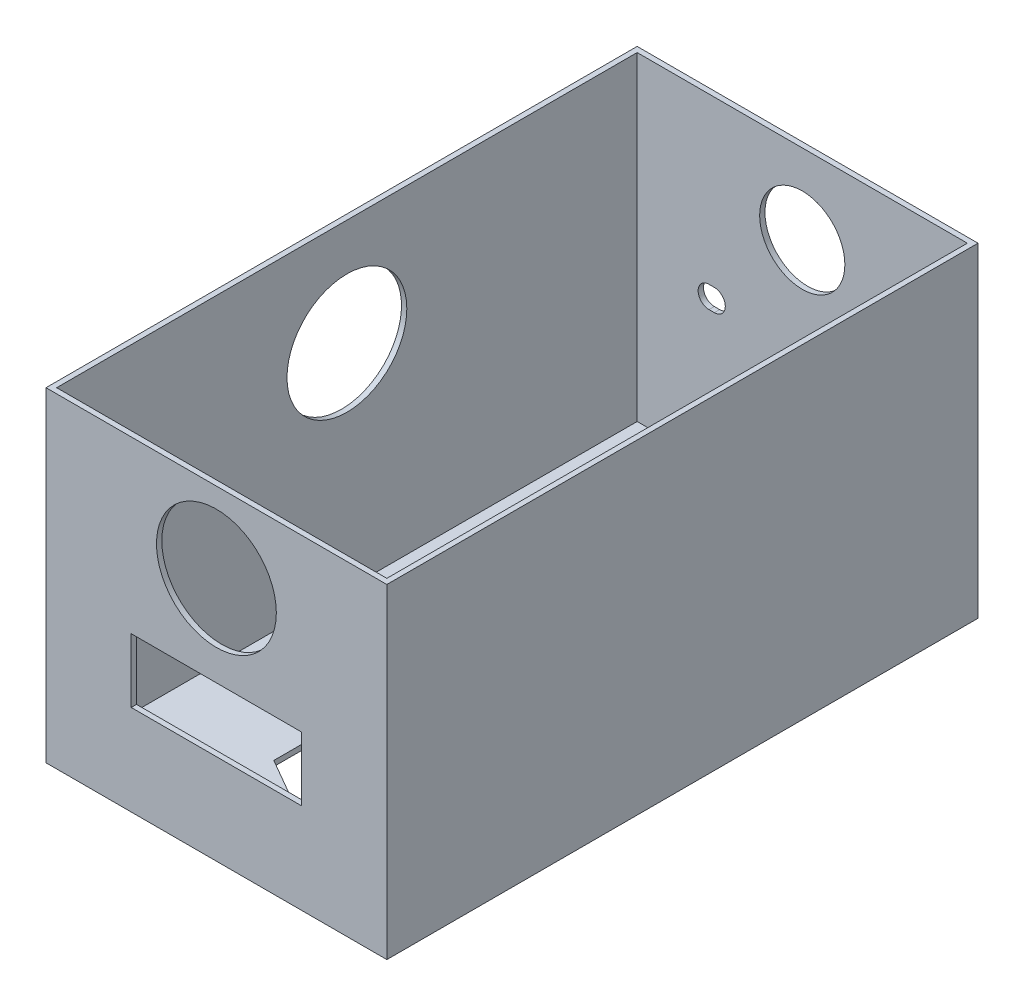
from build123d import *

# Parameters (mm, degrees)
IZIM1_W                     = 60
IZIM1_H                     = 60
Y_KSEKLIK_EKSTR_ZYON1_DEPTH = 1
IZIM2_R                     = 1.6
Y_KSEKLIK_EKSTR_ZYON2_DEPTH = 7
IZIM3_W                     = 60
IZIM3_H                     = 1
Y_KSEKLIK_EKSTR_ZYON3_DEPTH = 2
IZIM4_W                     = 39
IZIM4_H                     = 1
Y_KSEKLIK_EKSTR_ZYON4_DEPTH = 51
IZIM5_R                     = 1.6
Y_KSEKLIK_EKSTR_ZYON5_DEPTH = 5
IZIM6_W                     = 51
IZIM6_H                     = 1
Y_KSEKLIK_EKSTR_ZYON6_DEPTH = 12.5
IZIM7_W                     = 51
IZIM7_H                     = 1
Y_KSEKLIK_EKSTR_ZYON7_DEPTH = 12.5
KES_EKSTR_ZYON1_DEPTH       = 88.372764635
IZIM9_W                     = 64
IZIM9_H                     = 111
IZIM9_W_2                   = 62
IZIM9_H_2                   = 109
Y_KSEKLIK_EKSTR_ZYON8_DEPTH = 60
KES_EKSTR_ZYON2_REACH       = 132.637
IZIM10_R                    = 11.25
IZIM10_W                    = 32
IZIM10_H                    = 12
KES_EKSTR_ZYON3_REACH       = 121.908
IZIM11_R                    = 11.25
KES_EKSTR_ZYON4_REACH       = 132.637
IZIM12_R                    = 8
IZIM12_R_2                  = 2.55
KES_EKSTR_ZYON5_REACH       = 132.637
IZIM14_W                    = 9
IZIM14_H                    = 11.4


with BuildPart() as part:
    # Çizim1 → Yükseklik-Ekstrüzyon1 (new body)
    with BuildSketch(Plane(origin=(0, 0, 0), x_dir=(1, 0, 0), z_dir=(0, 1, 0))):
        Rectangle(IZIM1_W, IZIM1_H)
    extrude(amount=Y_KSEKLIK_EKSTR_ZYON1_DEPTH)

    # Çizim2 → Yükseklik-Ekstrüzyon2 (add)
    with BuildSketch(Plane(origin=(0, 1, 0), x_dir=(1, 0, 0), z_dir=(0, 1, 0))):
        with Locations(Location((-10, -25, 0), (0, 0, 270))):
            Circle(IZIM2_R)
        with Locations(Location((15, -25, 0), (0, 0, 270))):
            Circle(IZIM2_R)
        with Locations(Location((-10, 27, 0), (0, 0, 270))):
            Circle(IZIM2_R)
        with Locations(Location((15, 27, 0), (0, 0, 270))):
            Circle(IZIM2_R)
    extrude(amount=Y_KSEKLIK_EKSTR_ZYON2_DEPTH)

    # Çizim3 → Yükseklik-Ekstrüzyon3 (add)
    with BuildSketch(Plane(origin=(30, 0, 0), x_dir=(0, 0, -1), z_dir=(1, 0, 0))):
        with Locations((0, 0.5)):
            Rectangle(IZIM3_W, IZIM3_H)
    y_kseklik_ekstr_zyon3 = extrude(amount=Y_KSEKLIK_EKSTR_ZYON3_DEPTH)

    # Aynalama1: Yükseklik-Ekstrüzyon3 across plane
    add(y_kseklik_ekstr_zyon3.mirror(Plane(origin=(0, 0, 0), x_dir=(0, 0, 1), z_dir=(1, 0, 0))))

    # Çizim4 → Yükseklik-Ekstrüzyon4 (add)
    with BuildSketch(Plane.XY.offset(30)):
        with Locations((0, 0.5)):
            Rectangle(IZIM4_W, IZIM4_H)
    extrude(amount=Y_KSEKLIK_EKSTR_ZYON4_DEPTH)

    # Çizim5 → Yükseklik-Ekstrüzyon5 (add)
    with BuildSketch(Plane(origin=(0, 1, 0), x_dir=(1, 0, 0), z_dir=(0, 1, 0))):
        with Locations(Location((-16.5, -32, 0), (0, 0, 270))):
            Circle(IZIM5_R)
        with Locations(Location((16.5, -32, 0), (0, 0, 90))):
            Circle(IZIM5_R)
        with Locations(Location((-16.5, -78, 0), (0, 0, 270))):
            Circle(IZIM5_R)
        with Locations(Location((16.5, -78, 0), (0, 0, 90))):
            Circle(IZIM5_R)
    extrude(amount=Y_KSEKLIK_EKSTR_ZYON5_DEPTH)

    # Çizim6 → Yükseklik-Ekstrüzyon6 (add)
    with BuildSketch(Plane(origin=(19.5, 0, 0), x_dir=(0, 0, -1), z_dir=(1, 0, 0))):
        with Locations((-55.5, 0.5)):
            Rectangle(IZIM6_W, IZIM6_H)
    extrude(amount=Y_KSEKLIK_EKSTR_ZYON6_DEPTH)

    # Çizim7 → Yükseklik-Ekstrüzyon7 (add)
    with BuildSketch(Plane.ZY.offset(19.5)):
        with Locations((55.5, 0.5)):
            Rectangle(IZIM7_W, IZIM7_H)
    extrude(amount=Y_KSEKLIK_EKSTR_ZYON7_DEPTH)

    # Çizim8 → Kes-Ekstrüzyon1 (cut, through all)
    with BuildSketch(Plane(origin=(0, 1, 0), x_dir=(1, 0, 0), z_dir=(0, 1, 0))):
        Polygon((-10, -5.773502692), (0, -11.547005384), (10, -5.773502692), (10, 5.773502692), (0, 11.547005384), (-10, 5.773502692), align=None)
        Polygon((-10, -60.226497308), (0, -66), (10, -60.226497308), (10, -48.679491924), (0, -42.905989232), (-10, -48.679491924), align=None)
    extrude(amount=-KES_EKSTR_ZYON1_DEPTH, mode=Mode.SUBTRACT)

    # Çizim9 → Yükseklik-Ekstrüzyon8 (add)
    with BuildSketch(Plane(origin=(0, 1, 0), x_dir=(1, 0, 0), z_dir=(0, 1, 0))):
        with Locations((0, -25.5)):
            Rectangle(IZIM9_W, IZIM9_H)
        with Locations((0, -25.5)):
            Rectangle(IZIM9_W_2, IZIM9_H_2, mode=Mode.SUBTRACT)
    extrude(amount=Y_KSEKLIK_EKSTR_ZYON8_DEPTH)

    # Çizim10 → Kes-Ekstrüzyon2 (cut, up to next)
    with BuildSketch(Plane.XY.offset(81), mode=Mode.PRIVATE) as kes_ekstr_zyon2_sk1:
        with Locations((0, 46)):
            Circle(IZIM10_R)
    kes_ekstr_zyon2_tool1 = extrude(kes_ekstr_zyon2_sk1.sketch, amount=-KES_EKSTR_ZYON2_REACH, mode=Mode.PRIVATE) & part.part
    # Çizim10 → Kes-Ekstrüzyon2 (cut, up to next)
    with BuildSketch(Plane.XY.offset(81), mode=Mode.PRIVATE) as kes_ekstr_zyon2_sk2:
        with Locations((0, 23)):
            Rectangle(IZIM10_W, IZIM10_H)
    kes_ekstr_zyon2_tool2 = extrude(kes_ekstr_zyon2_sk2.sketch, amount=-KES_EKSTR_ZYON2_REACH, mode=Mode.PRIVATE) & part.part
    add(kes_ekstr_zyon2_tool1.solids().sort_by_distance((0, 46, 81))[0], mode=Mode.SUBTRACT)
    add(kes_ekstr_zyon2_tool2.solids().sort_by_distance((0, 23, 81))[0], mode=Mode.SUBTRACT)

    # Çizim11 → Kes-Ekstrüzyon3 (cut, up to next)
    with BuildSketch(Plane.ZY.offset(32), mode=Mode.PRIVATE) as kes_ekstr_zyon3_sk1:
        with Locations((25.5, 41)):
            Circle(IZIM11_R)
    kes_ekstr_zyon3_tool1 = extrude(kes_ekstr_zyon3_sk1.sketch, amount=-KES_EKSTR_ZYON3_REACH, mode=Mode.PRIVATE) & part.part
    add(kes_ekstr_zyon3_tool1.solids().sort_by_distance((-32, 41, 25.5))[0], mode=Mode.SUBTRACT)

    # Çizim12 → Kes-Ekstrüzyon4 (cut, up to next)
    with BuildSketch(Plane(origin=(0, 0, -30), x_dir=(-1, 0, 0), z_dir=(0, 0, -1)), mode=Mode.PRIVATE) as kes_ekstr_zyon4_sk1:
        with Locations((0, 46)):
            Circle(IZIM12_R)
    kes_ekstr_zyon4_tool1 = extrude(kes_ekstr_zyon4_sk1.sketch, amount=-KES_EKSTR_ZYON4_REACH, mode=Mode.PRIVATE) & part.part
    # Çizim12 → Kes-Ekstrüzyon4 (cut, up to next)
    with BuildSketch(Plane(origin=(0, 0, -30), x_dir=(-1, 0, 0), z_dir=(0, 0, -1)), mode=Mode.PRIVATE) as kes_ekstr_zyon4_sk2:
        with Locations((-17, 28)):
            Circle(IZIM12_R_2)
    kes_ekstr_zyon4_tool2 = extrude(kes_ekstr_zyon4_sk2.sketch, amount=-KES_EKSTR_ZYON4_REACH, mode=Mode.PRIVATE) & part.part
    # Çizim12 → Kes-Ekstrüzyon4 (cut, up to next)
    with BuildSketch(Plane(origin=(0, 0, -30), x_dir=(-1, 0, 0), z_dir=(0, 0, -1)), mode=Mode.PRIVATE) as kes_ekstr_zyon4_sk3:
        with BuildLine():
            Line((16.5, 30.05), (17.5, 30.05))
            ThreePointArc((17.5, 30.05), (19.55, 28), (17.5, 25.95))
            Line((17.5, 25.95), (16.5, 25.95))
            ThreePointArc((16.5, 25.95), (14.45, 28), (16.5, 30.05))
        make_face()
    kes_ekstr_zyon4_tool3 = extrude(kes_ekstr_zyon4_sk3.sketch, amount=-KES_EKSTR_ZYON4_REACH, mode=Mode.PRIVATE) & part.part
    add(kes_ekstr_zyon4_tool1.solids().sort_by_distance((0, 46, -30))[0], mode=Mode.SUBTRACT)
    add(kes_ekstr_zyon4_tool2.solids().sort_by_distance((17, 28, -30))[0], mode=Mode.SUBTRACT)
    add(kes_ekstr_zyon4_tool3.solids().sort_by_distance((-17, 28, -30))[0], mode=Mode.SUBTRACT)

    # Çizim14 → Kes-Ekstrüzyon5 (cut, up to next)
    with BuildSketch(Plane(origin=(0, 0, -30), x_dir=(-1, 0, 0), z_dir=(0, 0, -1)), mode=Mode.PRIVATE) as kes_ekstr_zyon5_sk1:
        with Locations((-26.5, 10.7)):
            Rectangle(IZIM14_W, IZIM14_H)
    kes_ekstr_zyon5_tool1 = extrude(kes_ekstr_zyon5_sk1.sketch, amount=-KES_EKSTR_ZYON5_REACH, mode=Mode.PRIVATE) & part.part
    # Çizim14 → Kes-Ekstrüzyon5 (cut, up to next)
    with BuildSketch(Plane(origin=(0, 0, -30), x_dir=(-1, 0, 0), z_dir=(0, 0, -1)), mode=Mode.PRIVATE) as kes_ekstr_zyon5_sk2:
        with BuildLine():
            Line((-2.25, 19.5), (2.25, 19.5))
            ThreePointArc((2.25, 19.5), (4.25, 17.5), (2.25, 15.5))
            Line((2.25, 15.5), (-2.25, 15.5))
            ThreePointArc((-2.25, 15.5), (-4.25, 17.5), (-2.25, 19.5))
        make_face()
    kes_ekstr_zyon5_tool2 = extrude(kes_ekstr_zyon5_sk2.sketch, amount=-KES_EKSTR_ZYON5_REACH, mode=Mode.PRIVATE) & part.part
    add(kes_ekstr_zyon5_tool1.solids().sort_by_distance((26.5, 10.7, -30))[0], mode=Mode.SUBTRACT)
    add(kes_ekstr_zyon5_tool2.solids().sort_by_distance((0, 17.5, -30))[0], mode=Mode.SUBTRACT)


solid = part.part
